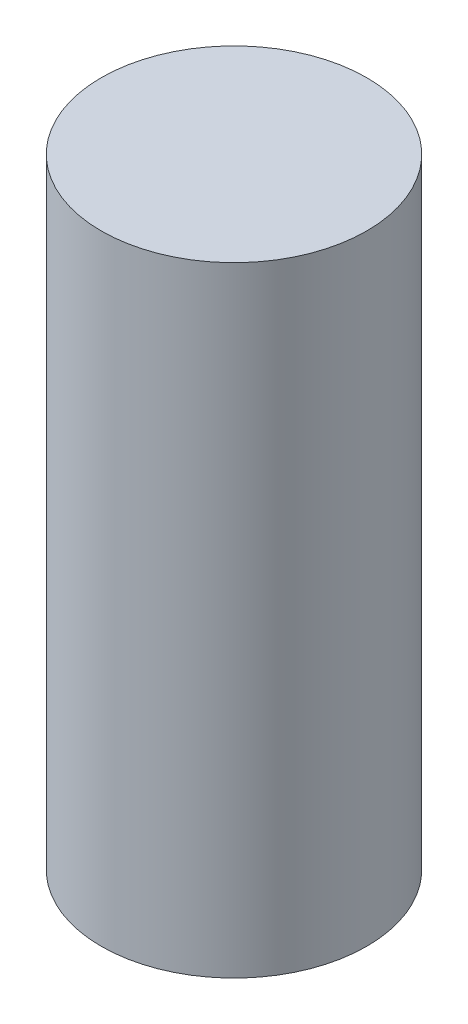
from build123d import *

# Parameters (mm, degrees)
TOPPING_AYAR_MIL_2_START = 12
SKETCH1_R                = 6
TOPPING_AYAR_MIL_2_DEPTH = 28


with BuildPart() as part:
    # Sketch1 → TOPPING_ayar_mil_2 (new body)
    with BuildSketch(Plane(origin=(0, 0, 0), x_dir=(1, 0, 0), z_dir=(0, 1, 0)).offset(TOPPING_AYAR_MIL_2_START)):
        with Locations(Location((650, 50, 0), (0, 0, 270))):
            Circle(SKETCH1_R)
    extrude(amount=TOPPING_AYAR_MIL_2_DEPTH)


solid = part.part
